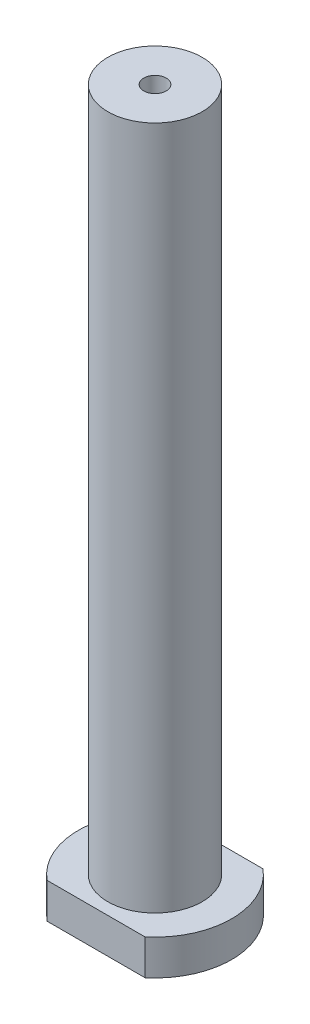
from build123d import *

# Parameters (mm, degrees)
SKETCH1_R           = 0.95
BOSS_EXTRUDE1_DEPTH = 3
SKETCH2_R           = 4
SKETCH2_R_2         = 0.95
BOSS_EXTRUDE2_DEPTH = 58


with BuildPart() as part:
    # Sketch1 → Boss-Extrude1 (new body)
    with BuildSketch(Plane(origin=(0, 0, 0), x_dir=(1, 0, 0), z_dir=(0, 1, 0))):
        with BuildLine():
            Line((-4.153311931, -5), (4.153311931, -5))
            ThreePointArc((4.153311931, -5), (6.5, 0), (4.153311931, 5))
            Line((4.153311931, 5), (-4.153311931, 5))
            ThreePointArc((-4.153311931, 5), (-6.5, 0), (-4.153311931, -5))
        make_face()
        with Locations(Location((0, 0, 0), (0, 0, 270))):
            Circle(SKETCH1_R, mode=Mode.SUBTRACT)
    extrude(amount=BOSS_EXTRUDE1_DEPTH)

    # Sketch2 → Boss-Extrude2 (add)
    with BuildSketch(Plane(origin=(0, 3, 0), x_dir=(1, 0, 0), z_dir=(0, 1, 0))):
        with Locations(Location((0, 0, 0), (0, 0, 90))):
            Circle(SKETCH2_R)
        with Locations(Location((0, 0, 0), (0, 0, 270))):
            Circle(SKETCH2_R_2, mode=Mode.SUBTRACT)
    extrude(amount=BOSS_EXTRUDE2_DEPTH)


solid = part.part
